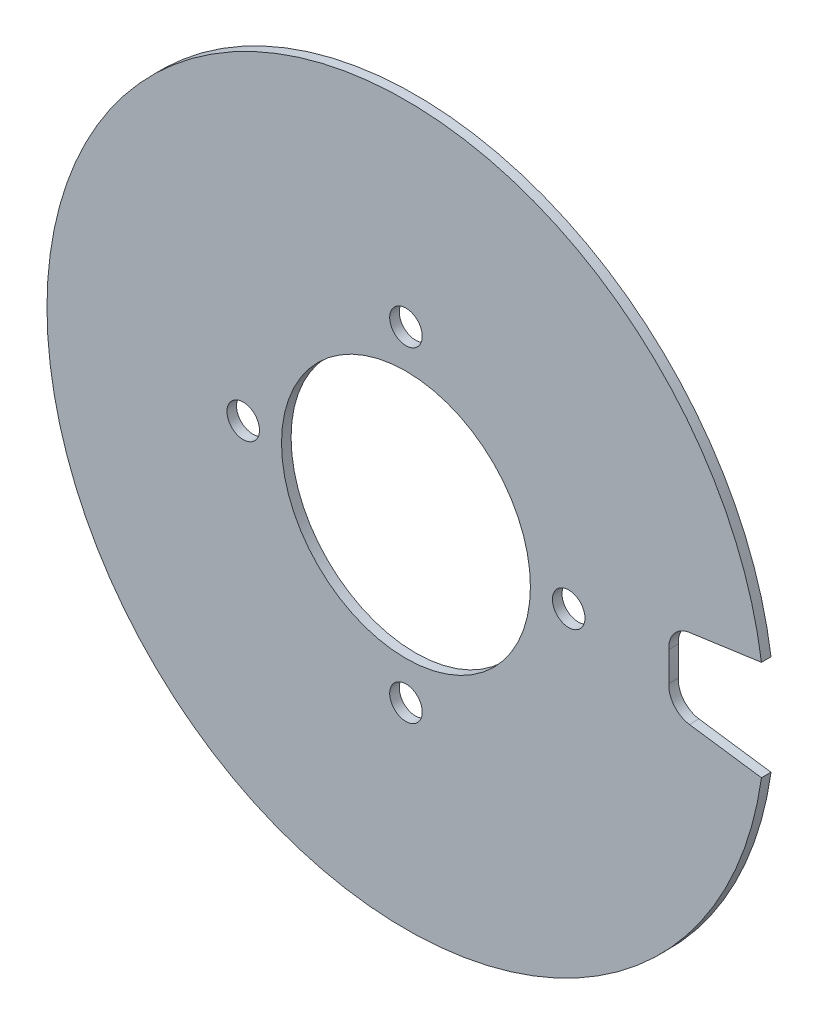
from build123d import *

# Parameters (mm, degrees)
SKETCH1_R                   = 37.5
BOSS_EXTRUDE1_DEPTH         = 1
SKETCH2_R                   = 13
CUT_EXTRUDE1_DEPTH          = 54.042435842
TAP_DRILL_FOR_M3X0_5_TAP1_D = 3.4
CUT_EXTRUDE2_DEPTH          = 54.042435842
FILLET1_R                   = 2.5


with BuildPart() as part:
    # Sketch1 → Boss-Extrude1 (new body)
    with BuildSketch(Plane.XY):
        Circle(SKETCH1_R)
    extrude(amount=BOSS_EXTRUDE1_DEPTH)

    # Sketch2 → Cut-Extrude1 (cut, through all)
    with BuildSketch(Plane.XY.offset(1)):
        Circle(SKETCH2_R)
    extrude(amount=-CUT_EXTRUDE1_DEPTH, mode=Mode.SUBTRACT)

    # Tap Drill for M3x0.5 Tap1 (through all)
    with Locations(Plane.XY.offset(1)):
        with Locations((0, 17), (17, 0), (0, -17), (-17, 0)):
            Hole(TAP_DRILL_FOR_M3X0_5_TAP1_D / 2)

    # Sketch5 → Cut-Extrude2 (cut, through all)
    with BuildSketch(Plane.XY.offset(1)):
        with BuildLine():
            Line((27.23237189, 3.827260276), (37.135052578, 5.218991286))
            ThreePointArc((37.135052578, 5.218991286), (37.5, 0), (37.135052578, -5.218991286))
            Line((37.135052578, -5.218991286), (27.23237189, -3.827260276))
            ThreePointArc((27.23237189, -3.827260276), (27.5, 0), (27.23237189, 3.827260276))
        make_face()
    extrude(amount=-CUT_EXTRUDE2_DEPTH, mode=Mode.SUBTRACT)

    # Fillet1
    fillet1_edges = [part.edges().sort_by_distance(p)[0] for p in [
        (27.23237189, -3.827260276, 0.5),
        (27.23237189, 3.827260276, 0.5),
    ]]
    fillet(fillet1_edges, radius=FILLET1_R)


solid = part.part
